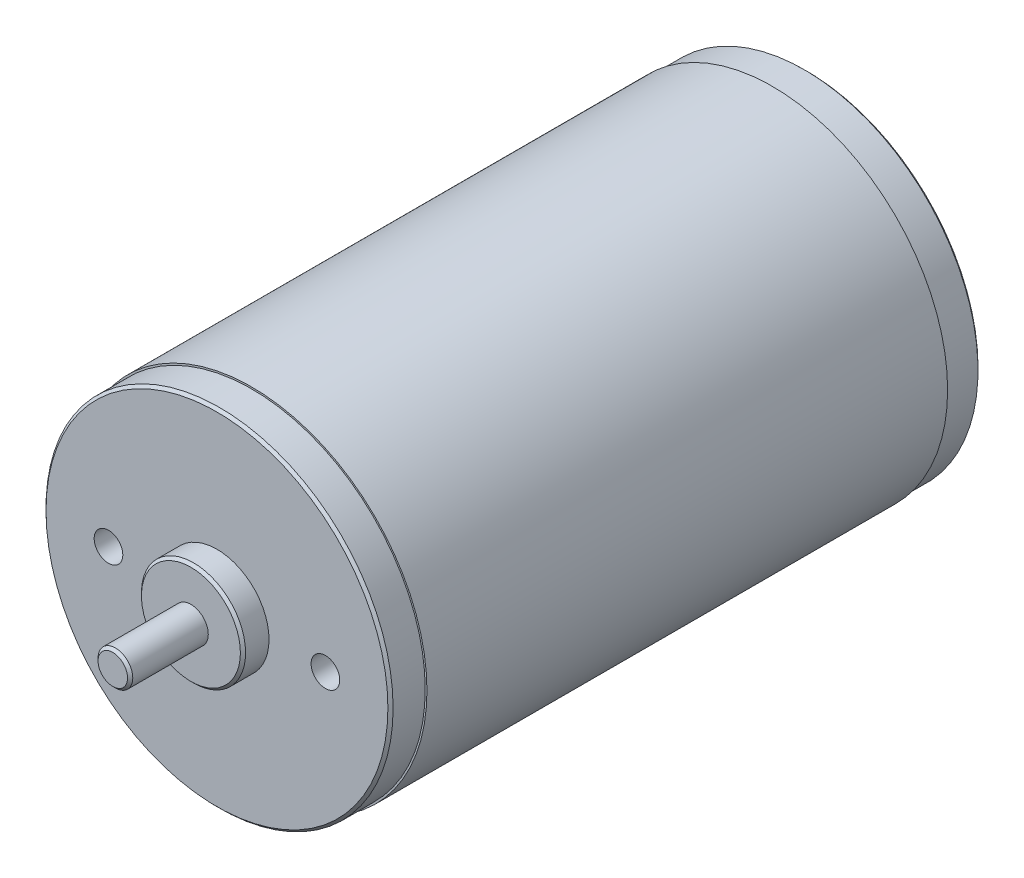
from build123d import *

# Parameters (mm, degrees)
SKETCH1_W                      = 20.2
SKETCH1_H                      = 60
SKETCH2_R                      = 20
BOSS_EXTRUDE1_DEPTH            = 4
SKETCH3_R                      = 6
BOSS_EXTRUDE2_DEPTH            = 3
SKETCH4_R                      = 2
BOSS_EXTRUDE3_DEPTH            = 9
BOSS_EXTRUDE4_START            = 4
SKETCH5_R                      = 20
BOSS_EXTRUDE4_DEPTH            = 4
SKETCH6_R                      = 6.325
BOSS_EXTRUDE5_DEPTH            = 1.5
F_3_3_3_3_DIAMETER_HOLE1_D     = 3.3
F_3_3_3_3_DIAMETER_HOLE1_DEPTH = 8.1
F_3_3_3_3_DIAMETER_HOLE1_TIP   = 0.991420021
CHAMFER1_SIZE                  = 0.3


with BuildPart() as part:
    # Sketch1 → Revolve1 (revolve)
    with BuildSketch(Plane(origin=(0, 0, 0), x_dir=(1, 0, 0), z_dir=(0, 1, 0))):
        with Locations((10.1, 34)):
            Rectangle(SKETCH1_W, SKETCH1_H)
    revolve(axis=Axis((0, 0, -64), (0, 0, 1)))

    # Sketch2 → Boss-Extrude1 (add)
    with BuildSketch(Plane.XY.offset(-4)):
        Circle(SKETCH2_R)
    extrude(amount=BOSS_EXTRUDE1_DEPTH)

    # Sketch3 → Boss-Extrude2 (add)
    with BuildSketch(Plane.XY):
        Circle(SKETCH3_R)
    extrude(amount=BOSS_EXTRUDE2_DEPTH)

    # Sketch4 → Boss-Extrude3 (add)
    with BuildSketch(Plane.XY.offset(3)):
        Circle(SKETCH4_R)
    extrude(amount=BOSS_EXTRUDE3_DEPTH)

    # Sketch5 → Boss-Extrude4 (add)
    with BuildSketch(Plane(origin=(0, 0, -64), x_dir=(-1, 0, 0), z_dir=(0, 0, -1)).offset(BOSS_EXTRUDE4_START)):
        Circle(SKETCH5_R)
    extrude(amount=-BOSS_EXTRUDE4_DEPTH)

    # Sketch6 → Boss-Extrude5 (add)
    with BuildSketch(Plane(origin=(0, 0, -68), x_dir=(-1, 0, 0), z_dir=(0, 0, -1))):
        Circle(SKETCH6_R)
    extrude(amount=BOSS_EXTRUDE5_DEPTH)

    # Ø3.3 (3.3) Diameter Hole1
    with Locations(Plane.XY):
        with Locations((-12.5, 0), (12.5, 0)):
            Hole(F_3_3_3_3_DIAMETER_HOLE1_D / 2, depth=F_3_3_3_3_DIAMETER_HOLE1_DEPTH)
            with Locations((0, 0, -(F_3_3_3_3_DIAMETER_HOLE1_DEPTH + F_3_3_3_3_DIAMETER_HOLE1_TIP / 2))):  # 118° drill point
                Cone(0, F_3_3_3_3_DIAMETER_HOLE1_D / 2, F_3_3_3_3_DIAMETER_HOLE1_TIP, mode=Mode.SUBTRACT)

    # Chamfer1
    chamfer1_edges = [part.edges().sort_by_distance(p)[0] for p in [
        (20, 0, -68),
        (-2, 0, 12),
        (-20, 0, 0),
        (6.325, 0, -69.5),
        (-6, 0, 3),
    ]]
    chamfer(chamfer1_edges, length=CHAMFER1_SIZE)


solid = part.part
